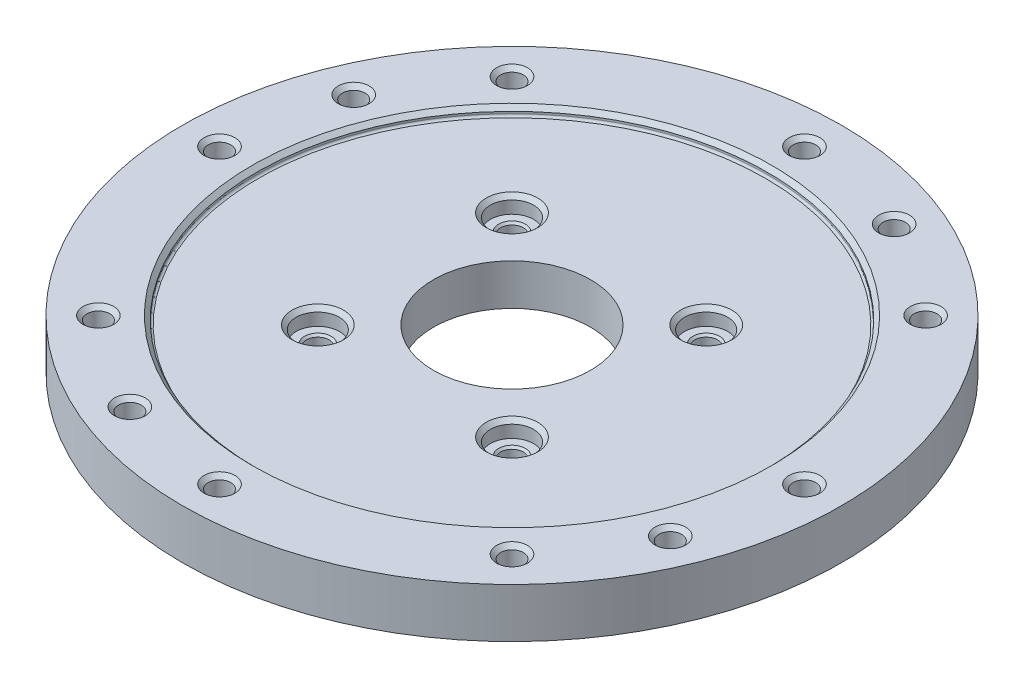
from build123d import *

# Parameters (mm, degrees)
SKETCH1_R           = 80
SKETCH1_R_2         = 19.075
BOSS_EXTRUDE1_DEPTH = 12
SKETCH2_R           = 2.75
CUT_EXTRUDE1_DEPTH  = 114.771701227
SKETCH3_R           = 5.25
CUT_EXTRUDE2_DEPTH  = 6
SKETCH4_R           = 62.1
CUT_EXTRUDE3_DEPTH  = 2
SKETCH5_R           = 2.75
CUT_EXTRUDE4_DEPTH  = 114.771701227
SKETCH8_R           = 6.5
CUT_EXTRUDE5_DEPTH  = 5
FILLET1_R           = 0.5
CHAMFER1_SIZE       = 1
CHAMFER2_SIZE       = 1
CHAMFER3_SIZE       = 1
CHAMFER4_SIZE       = 0.5


with BuildPart() as part:
    # Sketch1 → Boss-Extrude1 (new body)
    with BuildSketch(Plane(origin=(0, 0, 0), x_dir=(1, 0, 0), z_dir=(0, 1, 0))):
        Circle(SKETCH1_R)
        Circle(SKETCH1_R_2, mode=Mode.SUBTRACT)
    extrude(amount=BOSS_EXTRUDE1_DEPTH)

    # Sketch2 → Cut-Extrude1 (cut, through all)
    with BuildSketch(Plane(origin=(0, 12, 0), x_dir=(1, 0, 0), z_dir=(0, 1, 0))):
        with Locations((-23.57, 23.57)):
            Circle(SKETCH2_R)
        with Locations((23.57, 23.57)):
            Circle(SKETCH2_R)
        with Locations((-23.57, -23.57)):
            Circle(SKETCH2_R)
        with Locations((23.57, -23.57)):
            Circle(SKETCH2_R)
    extrude(amount=-CUT_EXTRUDE1_DEPTH, mode=Mode.SUBTRACT)

    # Sketch3 → Cut-Extrude2 (cut)
    with BuildSketch(Plane(origin=(0, 12, 0), x_dir=(1, 0, 0), z_dir=(0, 1, 0))):
        with Locations((-23.57, 23.57)):
            Circle(SKETCH3_R)
        with Locations((23.57, 23.57)):
            Circle(SKETCH3_R)
        with Locations((-23.57, -23.57)):
            Circle(SKETCH3_R)
        with Locations((23.57, -23.57)):
            Circle(SKETCH3_R)
    extrude(amount=-CUT_EXTRUDE2_DEPTH, mode=Mode.SUBTRACT)

    # Sketch4 → Cut-Extrude3 (cut)
    with BuildSketch(Plane(origin=(0, 12, 0), x_dir=(1, 0, 0), z_dir=(0, 1, 0))):
        Circle(SKETCH4_R)
    extrude(amount=-CUT_EXTRUDE3_DEPTH, mode=Mode.SUBTRACT)

    # Sketch5 → Cut-Extrude4 (cut, through all)
    with BuildSketch(Plane(origin=(0, 12, 0), x_dir=(1, 0, 0), z_dir=(0, 1, 0))):
        with Locations((0, 71)):
            Circle(SKETCH5_R)
        with Locations((27.170523698, 65.595446808)):
            Circle(SKETCH5_R)
        with Locations((50.204581464, 50.204581464)):
            Circle(SKETCH5_R)
        with Locations((71, 0)):
            Circle(SKETCH5_R)
        with Locations((50.204581464, -50.204581464)):
            Circle(SKETCH5_R)
        with Locations((0, -71)):
            Circle(SKETCH5_R)
        with Locations((-50.204581464, -50.204581464)):
            Circle(SKETCH5_R)
        with Locations((-71, 0)):
            Circle(SKETCH5_R)
        with Locations((-50.204581464, 50.204581464)):
            Circle(SKETCH5_R)
        with Locations((65.595446808, -27.170523698)):
            Circle(SKETCH5_R)
        with Locations((-27.170523698, -65.595446808)):
            Circle(SKETCH5_R)
        with Locations((-65.595446808, 27.170523698)):
            Circle(SKETCH5_R)
    extrude(amount=-CUT_EXTRUDE4_DEPTH, mode=Mode.SUBTRACT)

    # Sketch8 → Cut-Extrude5 (cut)
    with BuildSketch(Plane.XZ):
        with Locations((0, -71)):
            Circle(SKETCH8_R)
        with Locations((-50.204581464, -50.204581464)):
            Circle(SKETCH8_R)
        with Locations((-71, 0)):
            Circle(SKETCH8_R)
        with Locations((-50.204581464, 50.204581464)):
            Circle(SKETCH8_R)
        with Locations((0, 71)):
            Circle(SKETCH8_R)
        with Locations((50.204581464, 50.204581464)):
            Circle(SKETCH8_R)
        with Locations((71, 0)):
            Circle(SKETCH8_R)
        with Locations((50.204581464, -50.204581464)):
            Circle(SKETCH8_R)
    extrude(amount=-CUT_EXTRUDE5_DEPTH, mode=Mode.SUBTRACT)

    # Fillet1
    fillet1_edges = [part.edges().sort_by_distance(p)[0] for p in [
        (-62.1, 10, 0),
    ]]
    fillet(fillet1_edges, radius=FILLET1_R)

    # Chamfer1
    chamfer1_edges = [part.edges().sort_by_distance(p)[0] for p in [
        (-62.1, 12, 0),
    ]]
    chamfer(chamfer1_edges, length=CHAMFER1_SIZE)

    # Chamfer2
    chamfer2_edges = [part.edges().sort_by_distance(p)[0] for p in [
        (24.420523698, 12, -65.595446808),
        (-2.75, 12, -71),
        (-28.82, 10, -23.57),
        (18.32, 10, -23.57),
        (18.32, 10, 23.57),
        (-28.82, 10, 23.57),
        (-68.345446808, 12, -27.170523698),
        (-73.75, 12, 0),
        (-52.954581464, 12, 50.204581464),
        (-29.920523698, 12, 65.595446808),
        (-2.75, 12, 71),
        (47.454581464, 12, 50.204581464),
        (62.845446808, 12, 27.170523698),
        (68.25, 12, 0),
        (47.454581464, 12, -50.204581464),
        (-52.954581464, 12, -50.204581464),
    ]]
    chamfer(chamfer2_edges, length=CHAMFER2_SIZE)

    # Chamfer3
    chamfer3_edges = [part.edges().sort_by_distance(p)[0] for p in [
        (-6.5, 0, -71),
        (43.704581464, 0, -50.204581464),
        (64.5, 0, 0),
        (43.704581464, 0, 50.204581464),
        (-6.5, 0, 71),
        (-56.704581464, 0, 50.204581464),
        (-77.5, 0, 0),
        (-56.704581464, 0, -50.204581464),
    ]]
    chamfer(chamfer3_edges, length=CHAMFER3_SIZE)

    # Chamfer4
    chamfer4_edges = [part.edges().sort_by_distance(p)[0] for p in [
        (-26.32, 6, 23.57),
        (20.82, 6, 23.57),
        (20.82, 6, -23.57),
        (-26.32, 6, -23.57),
    ]]
    chamfer(chamfer4_edges, length=CHAMFER4_SIZE)


solid = part.part
